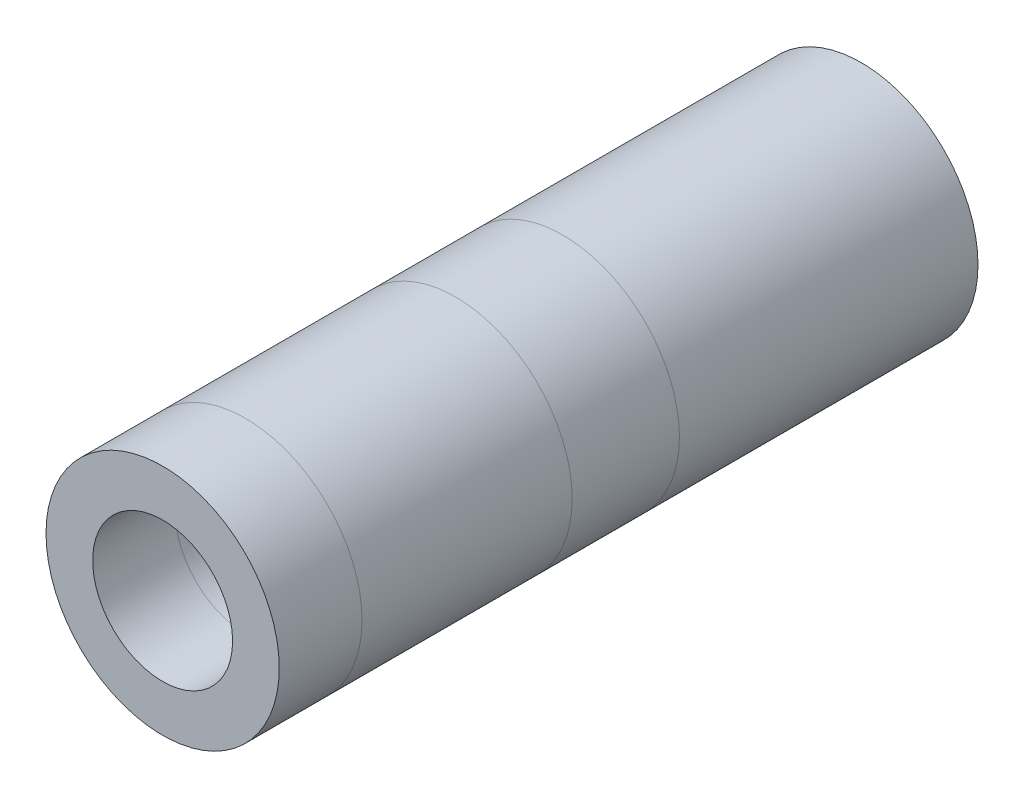
from build123d import *

# Parameters (mm, degrees)
SWEEP1_PROFILE_R     = 7.9375
CUT_SWEEP1_PROFILE_R = 4.7625


with BuildPart() as part:
    # Sweep1: sweep along a curve in space
    with BuildLine() as sweep1_path:
        Line((0, 0, -7.3), (0, 0, -27.62))
        Line((0, 0, 0), (0, 0, -7.3))
        Line((0, 0, 14.30200009), (0, 0, 0))
        Line((0, 0, 14.30200009), (0, 0, 19.9354445))
    # Sweep1 profile (on start of the path) → Sweep1 (sweep)
    with BuildSketch(Plane(origin=(0, 0, 19.9354445), x_dir=(-1, 0, 0), z_dir=(0, 0, -1))):
        Circle(SWEEP1_PROFILE_R)
    sweep(path=sweep1_path.line)

    # Cut-Sweep1: sweep along a curve in space
    with BuildLine() as cut_sweep1_path:
        Line((0, 0, -7.3), (0, 0, -27.62))
        Line((0, 0, 0), (0, 0, -7.3))
        Line((0, 0, 14.30200009), (0, 0, 0))
        Line((0, 0, 14.30200009), (0, 0, 19.9354445))
    # Cut-Sweep1 profile (on start of the path) → Cut-Sweep1 (sweep, cut)
    with BuildSketch(Plane(origin=(0, 0, 19.9354445), x_dir=(-1, 0, 0), z_dir=(0, 0, -1))):
        Circle(CUT_SWEEP1_PROFILE_R)
    sweep(path=cut_sweep1_path.line, mode=Mode.SUBTRACT)


solid = part.part
